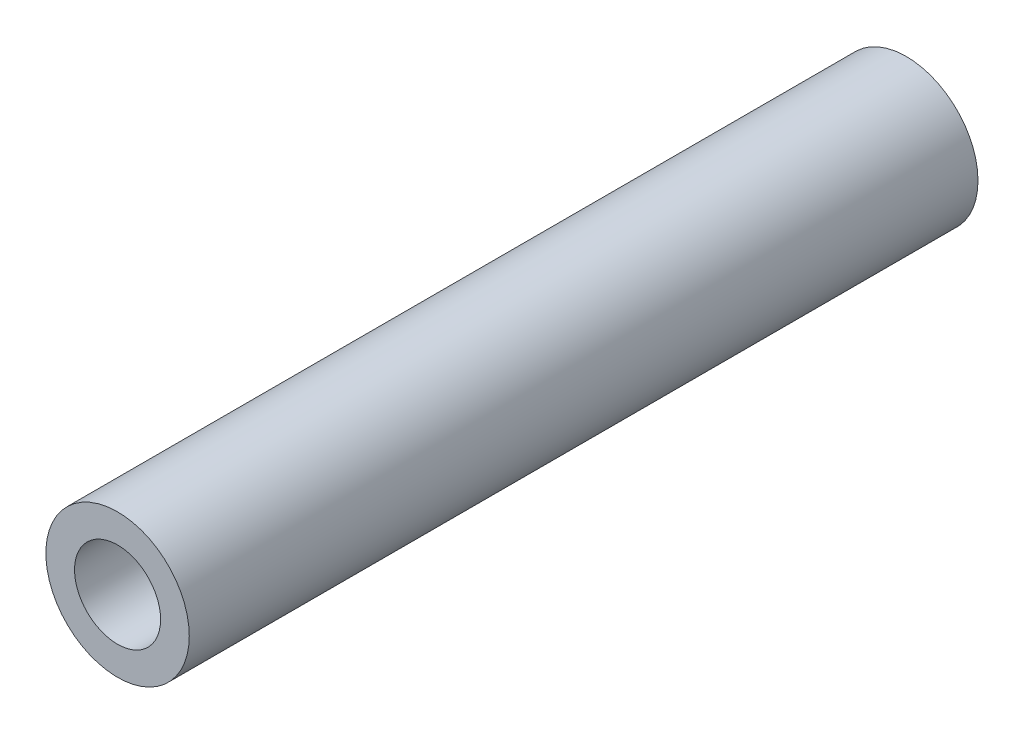
from build123d import *

# Parameters (mm, degrees)
BOSS_EXTRUDE1_DEPTH      = 25
BOSS_EXTRUDE1_DEPTH_BACK = 2.5
SKETCH1_R                = 2.5
SKETCH3_R                = 1.5
CUT_EXTRUDE1_DEPTH       = 6
CUT_EXTRUDE2_START       = -6
SKETCH2_R                = 1.5
CUT_EXTRUDE2_DEPTH       = 6


with BuildPart() as part:
    # Sketch1 → Boss-Extrude1 (new, two sides: drawn at the far end of the back side and taken through both)
    with BuildSketch(Plane.XY.offset(-BOSS_EXTRUDE1_DEPTH_BACK)):
        Circle(SKETCH1_R)
    extrude(amount=BOSS_EXTRUDE1_DEPTH + BOSS_EXTRUDE1_DEPTH_BACK)

    # Sketch3 → Cut-Extrude1 (cut)
    with BuildSketch(Plane(origin=(0, 0, -2.5), x_dir=(-1, 0, 0), z_dir=(0, 0, -1))):
        Circle(SKETCH3_R)
    extrude(amount=-CUT_EXTRUDE1_DEPTH, mode=Mode.SUBTRACT)

    # Sketch2 → Cut-Extrude2 (cut)
    with BuildSketch(Plane.XY.offset(25).offset(CUT_EXTRUDE2_START)):
        with Locations(Location((0, 0, 0), (0, 0, 180))):
            Circle(SKETCH2_R)
    extrude(amount=CUT_EXTRUDE2_DEPTH, mode=Mode.SUBTRACT)


solid = part.part
